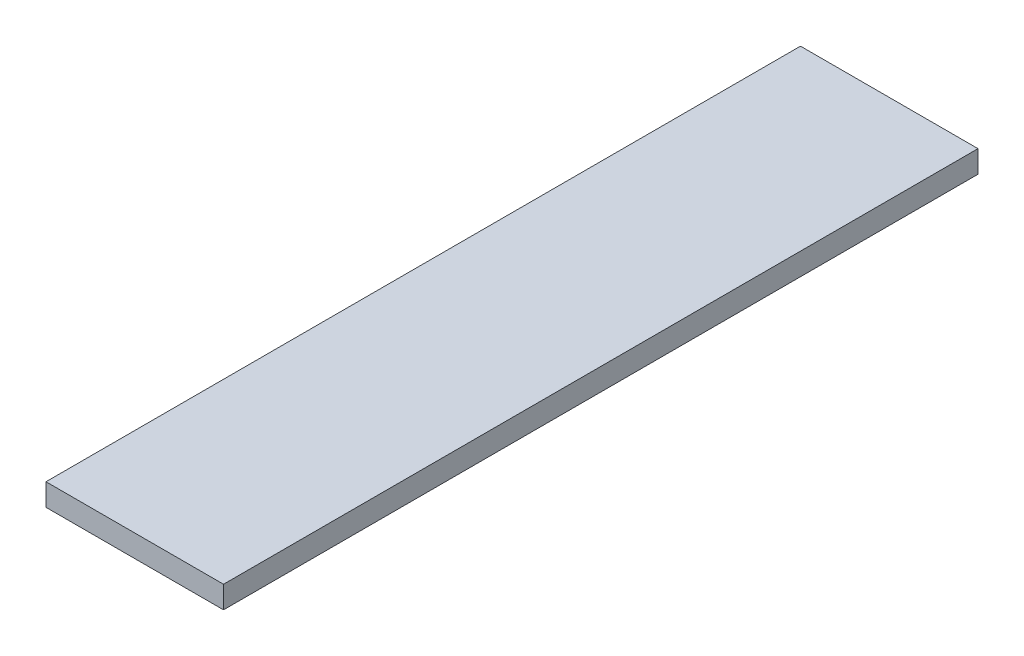
from build123d import *

# Parameters (mm, degrees)
SKETCH1_W           = 101.6
SKETCH1_H           = 431.8
BOSS_EXTRUDE1_DEPTH = 12.7


with BuildPart() as part:
    # Sketch1 → Boss-Extrude1 (new body)
    with BuildSketch(Plane(origin=(0, 0, 0), x_dir=(1, 0, 0), z_dir=(0, 1, 0))):
        with Locations((50.8, 215.9)):
            Rectangle(SKETCH1_W, SKETCH1_H)
    extrude(amount=BOSS_EXTRUDE1_DEPTH)


solid = part.part
